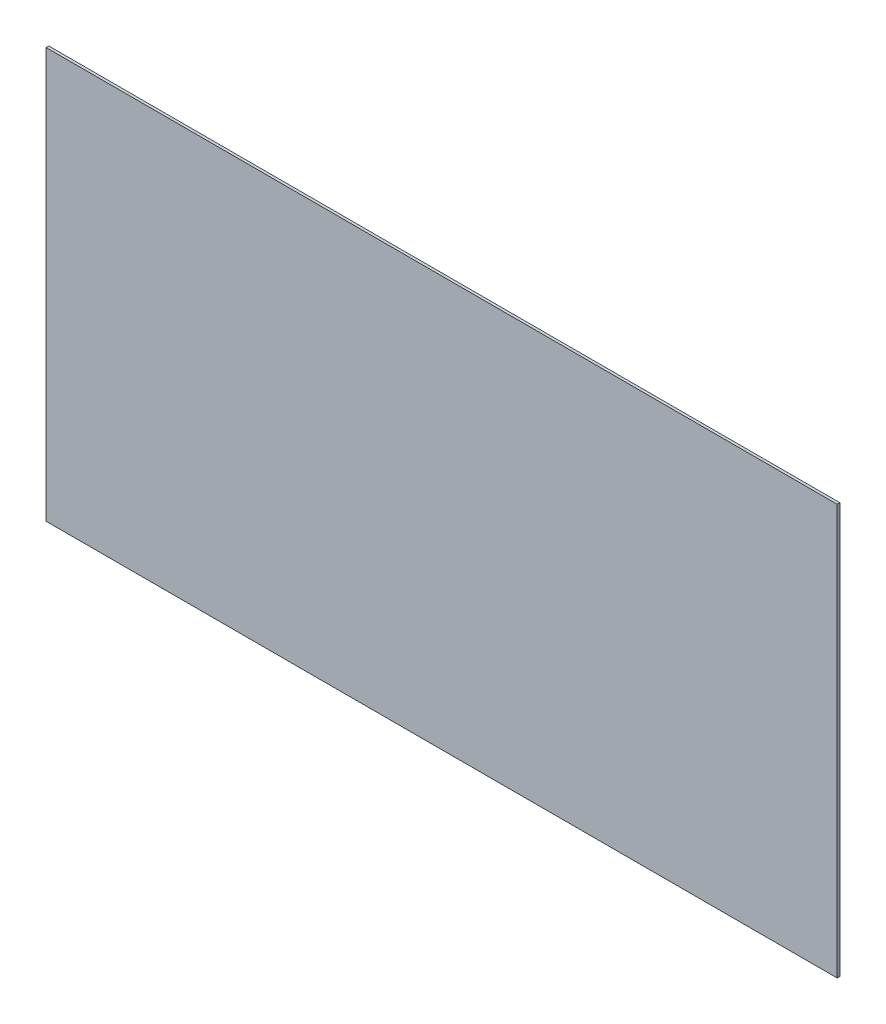
from build123d import *

# Parameters (mm, degrees)
SKETCH_1_W      = 295
SKETCH_1_H      = 153
EXTRUDE_1_DEPTH = 1


with BuildPart() as part:
    # 草图1 → 凸台-拉伸1 (new body)
    with BuildSketch(Plane.XY):
        with Locations((147.5, 76.5)):
            Rectangle(SKETCH_1_W, SKETCH_1_H)
    extrude(amount=EXTRUDE_1_DEPTH)


solid = part.part
